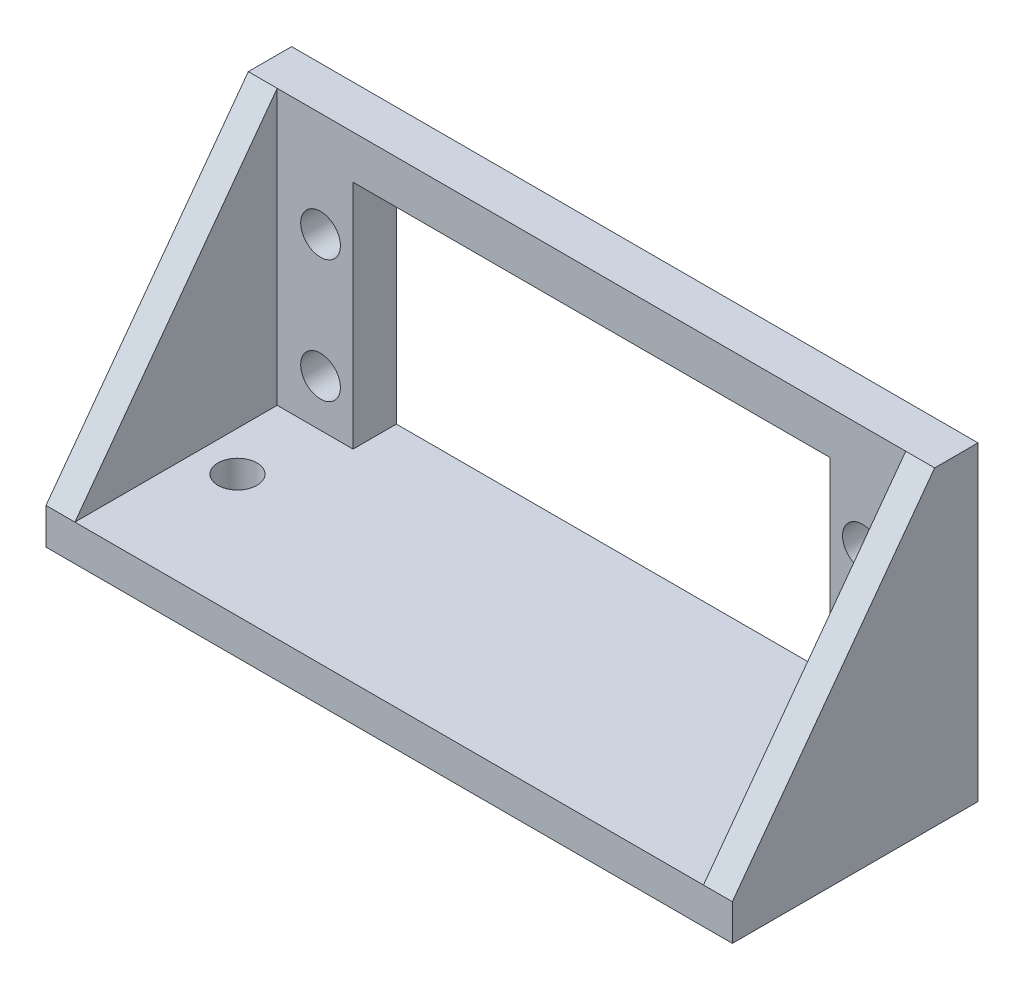
from build123d import *

# Parameters (mm, degrees)
SKETCH1_W           = 95
SKETCH1_H           = 34
BOSS_EXTRUDE1_DEPTH = 5
SKETCH2_W           = 14.5
SKETCH2_H           = 6
BOSS_EXTRUDE2_DEPTH = 38
SKETCH3_W           = 95
SKETCH3_H           = 6
BOSS_EXTRUDE3_DEPTH = 6
SKETCH4_R           = 2.75
CUT_EXTRUDE1_DEPTH  = 6
SKETCH6_R           = 2.7
CUT_EXTRUDE2_DEPTH  = 6
BOSS_EXTRUDE4_DEPTH = 4


with BuildPart() as part:
    # Sketch1 → Boss-Extrude1 (new body)
    with BuildSketch(Plane(origin=(0, 0, 0), x_dir=(1, 0, 0), z_dir=(0, 1, 0))):
        Rectangle(SKETCH1_W, SKETCH1_H)
    extrude(amount=BOSS_EXTRUDE1_DEPTH)

    # Sketch2 → Boss-Extrude2 (add)
    with BuildSketch(Plane(origin=(0, 5, 0), x_dir=(1, 0, 0), z_dir=(0, 1, 0))):
        with Locations((-40.25, 14)):
            Rectangle(SKETCH2_W, SKETCH2_H)
        with Locations((40.25, 14)):
            Rectangle(SKETCH2_W, SKETCH2_H)
    extrude(amount=BOSS_EXTRUDE2_DEPTH)

    # Sketch3 → Boss-Extrude3 (add)
    with BuildSketch(Plane(origin=(0, 43, 0), x_dir=(1, 0, 0), z_dir=(0, 1, 0))):
        with Locations((0, 14)):
            Rectangle(SKETCH3_W, SKETCH3_H)
    extrude(amount=-BOSS_EXTRUDE3_DEPTH)

    # Sketch4 → Cut-Extrude1 (cut)
    with BuildSketch(Plane(origin=(0, 0, -17), x_dir=(-1, 0, 0), z_dir=(0, 0, -1))):
        with Locations((37.5, 11.5)):
            Circle(SKETCH4_R)
        with Locations((37.5, 28.5)):
            Circle(SKETCH4_R)
        with Locations(Location((-37.5, 28.5, 0), (0, 0, 180))):
            Circle(SKETCH4_R)
        with Locations(Location((-37.5, 11.5, 0), (0, 0, 180))):
            Circle(SKETCH4_R)
    extrude(amount=-CUT_EXTRUDE1_DEPTH, mode=Mode.SUBTRACT)

    # Sketch6 → Cut-Extrude2 (cut)
    with BuildSketch(Plane(origin=(0, 5, 0), x_dir=(1, 0, 0), z_dir=(0, 1, 0))):
        with Locations(Location((-38, 0, 0), (0, 0, 270))):
            Circle(SKETCH6_R)
        with Locations(Location((38, 0, 0), (0, 0, 270))):
            Circle(SKETCH6_R)
    extrude(amount=-CUT_EXTRUDE2_DEPTH, mode=Mode.SUBTRACT)

    # Sketch7 → Boss-Extrude4 (add)
    with BuildSketch(Plane.ZY.offset(47.5)):
        Polygon((17, 5), (-11, 43), (-11, 5), align=None)
    boss_extrude4 = extrude(amount=-BOSS_EXTRUDE4_DEPTH)

    # Mirror1: Boss-Extrude4 across plane
    add(boss_extrude4.mirror(Plane(origin=(0, 0, 0), x_dir=(0, 0, 1), z_dir=(1, 0, 0))))


solid = part.part
